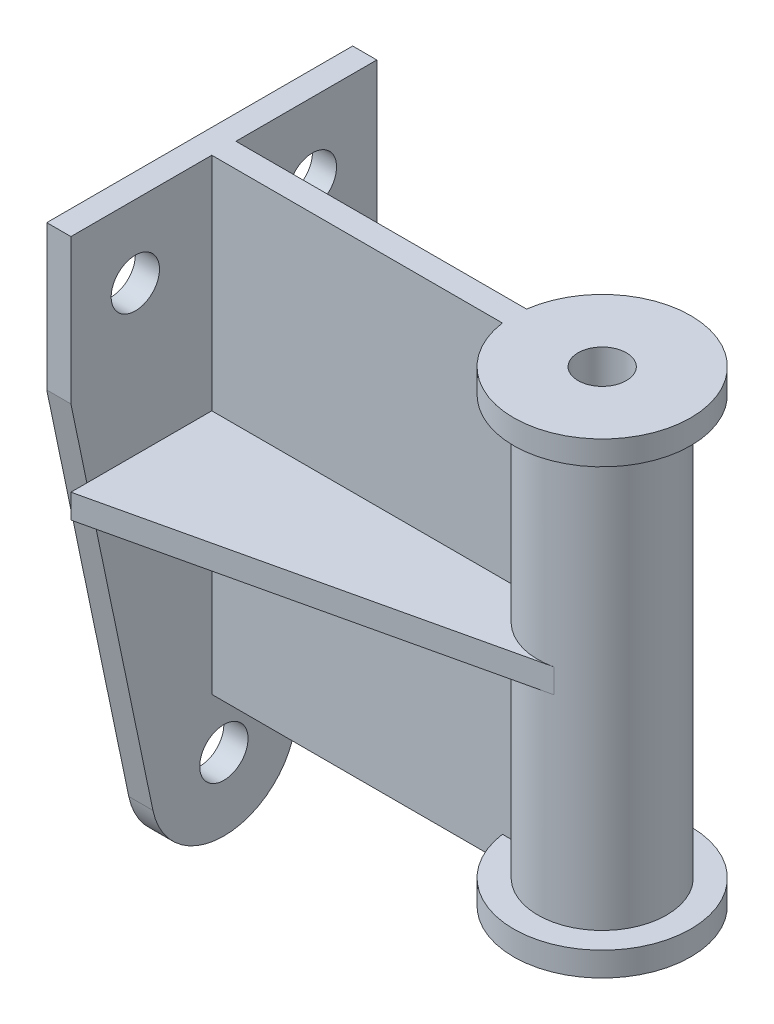
from build123d import *

# Parameters (mm, degrees)
SKETCH1_R           = 16
SKETCH1_R_2         = 6
BOSS_EXTRUDE1_DEPTH = 116
BOSS_EXTRUDE2_START = -6
SKETCH2_R           = 22
SKETCH2_R_2         = 6
BOSS_EXTRUDE2_DEPTH = 6
SKETCH3_R           = 22
SKETCH3_R_2         = 6
BOSS_EXTRUDE3_DEPTH = 6
BOSS_EXTRUDE4_DEPTH = 6
BOSS_EXTRUDE7_DEPTH = 3
BOSS_EXTRUDE8_DEPTH = 3
HOLE1_D             = 12
HOLE2_D             = 12


with BuildPart() as part:
    # Sketch1 → Boss-Extrude1 (new body)
    with BuildSketch(Plane(origin=(0, 0, 0), x_dir=(1, 0, 0), z_dir=(0, 1, 0))):
        with Locations(Location((0, 0, 0), (0, 0, 90))):
            Circle(SKETCH1_R)
        with Locations(Location((0, 0, 0), (0, 0, 90))):
            Circle(SKETCH1_R_2, mode=Mode.SUBTRACT)
    extrude(amount=BOSS_EXTRUDE1_DEPTH)

    # Sketch2 → Boss-Extrude2 (add)
    with BuildSketch(Plane(origin=(0, 116, 0), x_dir=(1, 0, 0), z_dir=(0, 1, 0)).offset(BOSS_EXTRUDE2_START)):
        with Locations(Location((0, 0, 0), (0, 0, 270))):
            Circle(SKETCH2_R)
        with Locations(Location((0, 0, 0), (0, 0, 90))):
            Circle(SKETCH2_R_2, mode=Mode.SUBTRACT)
    extrude(amount=BOSS_EXTRUDE2_DEPTH)

    # Sketch3 → Boss-Extrude3 (add)
    with BuildSketch(Plane.XZ):
        with Locations(Location((0, 0, 0), (0, 0, 90))):
            Circle(SKETCH3_R)
        with Locations(Location((0, 0, 0), (0, 0, 270))):
            Circle(SKETCH3_R_2, mode=Mode.SUBTRACT)
    extrude(amount=-BOSS_EXTRUDE3_DEPTH)



with BuildPart() as body_2:
    # Sketch4 → Boss-Extrude4 (new body)
    with BuildSketch(Plane(origin=(-100, 0, 0), x_dir=(0, 0, -1), z_dir=(1, 0, 0))):
        with BuildLine():
            Line((-38, 116), (38, 116))
            Line((38, 116), (38, 80))
            Line((38, 80), (17.620559303, -17.676396314))
            ThreePointArc((17.620559303, -17.676396314), (0, -32), (-17.620559303, -17.676396314))
            Line((-17.620559303, -17.676396314), (-38, 80))
            Line((-38, 80), (-38, 116))
        make_face()
    extrude(amount=BOSS_EXTRUDE4_DEPTH)


with BuildPart() as part_1:
    add(part.part)

    add(body_2.part)  # Boss-Extrude7 merges body 2
    # Sketch5 → Boss-Extrude7 (add, symmetric)
    with BuildSketch(Plane.XY):
        Polygon((-100, 116), (-21, 116), (-21, 110), (-15, 110), (-15, 6), (-21, 6), (-21, 0), (-100, 0), align=None)
    extrude(amount=BOSS_EXTRUDE7_DEPTH, both=True)

    # Sketch6 → Boss-Extrude8 (add, symmetric)
    with BuildSketch(Plane(origin=(0, 58, 0), x_dir=(1, 0, 0), z_dir=(0, 1, 0))):
        with BuildLine():
            Line((-94, 38), (-94, -38))
            Line((-94, -38), (3.580633879, -15.594199596))
            ThreePointArc((3.580633879, -15.594199596), (-16, 0), (3.580633879, 15.594199596))
            Line((3.580633879, 15.594199596), (-94, 38))
        make_face()
    extrude(amount=BOSS_EXTRUDE8_DEPTH, both=True)

    # Hole1 (through all)
    with Locations(Plane(origin=(-94, 0, 0), x_dir=(0, 0, -1), z_dir=(1, 0, 0))):
        with Locations((0, -14), (-22, 98)):
            Hole(HOLE1_D / 2)

    # Hole2 (through all)
    with Locations(Plane(origin=(-94, 0, 0), x_dir=(0, 0, -1), z_dir=(1, 0, 0))):
        with Locations((22, 98)):
            Hole(HOLE2_D / 2)


solid = part_1.part
